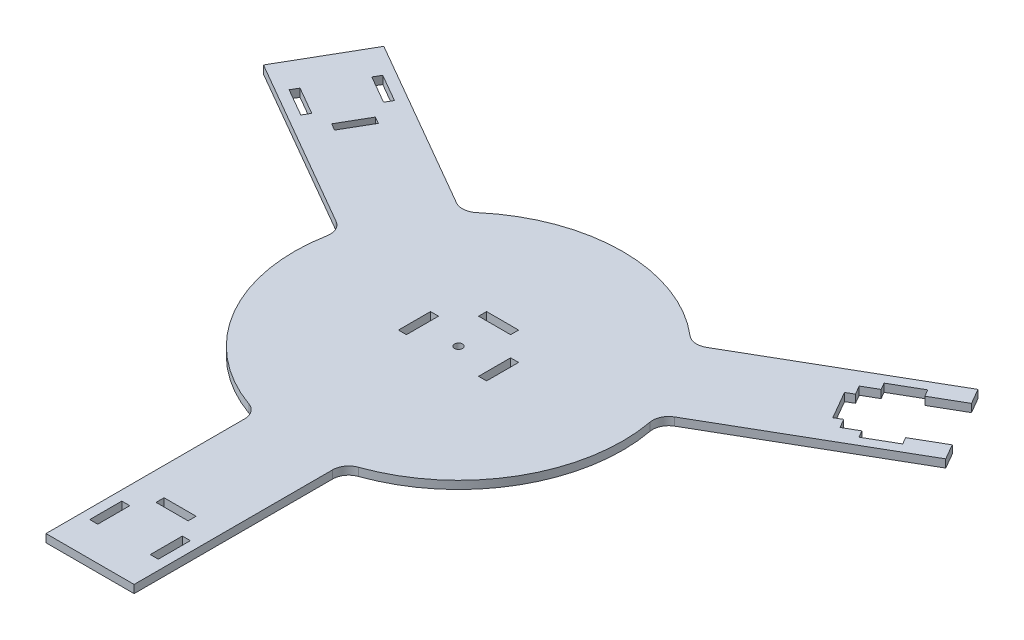
from build123d import *

# Parameters (mm, degrees)
SKETCH1_R      = 3.175
SKETCH1_W      = 25.4
SKETCH1_H      = 6.35
SKETCH1_W_2    = 6.35
SKETCH1_H_2    = 25.4
EXTRUDE2_DEPTH = 6.35
SKETCH2_W      = 6.35
SKETCH2_H      = 25.4
SKETCH2_W_2    = 25.4
SKETCH2_H_2    = 6.35
EXTRUDE4_DEPTH = 399.113447613


with BuildPart() as part:
    # Sketch1 → Extrude2 (new body)
    with BuildSketch(Plane(origin=(0, 0, 0), x_dir=(1, 0, 0), z_dir=(0, 1, 0))):
        with BuildLine():
            Line((-34.925, -292.1), (34.925, -292.1))
            Line((34.925, -292.1), (34.925, -134.703841816))
            ThreePointArc((34.925, -134.703841816), (37.255493422, -127.371493397), (43.391666667, -122.730166988))
            ThreePointArc((43.391666667, -122.730166988), (112.734856938, -65.0875), (127.983275756, 23.786797848))
            ThreePointArc((127.983275756, 23.786797848), (128.934695711, 31.421542964), (134.119449, 37.105983681))
            Line((134.119449, 37.105983681), (270.428520445, 115.804062773))
            Line((270.428520445, 115.804062773), (263.380020445, 128.01242289))
            Line((263.380020445, 128.01242289), (239.953167248, 114.48692289))
            Line((239.953167248, 114.48692289), (243.128167248, 108.987661576))
            Line((243.128167248, 108.987661576), (221.131121992, 96.287661576))
            Line((221.131121992, 96.287661576), (217.956121992, 101.78692289))
            Line((217.956121992, 101.78692289), (206.957599363, 95.43692289))
            Line((206.957599363, 95.43692289), (202.893599363, 102.475977372))
            Line((202.893599363, 102.475977372), (197.394338049, 99.300977372))
            Line((197.394338049, 99.300977372), (184.694338049, 121.298022628))
            Line((184.694338049, 121.298022628), (190.193599363, 124.473022628))
            Line((190.193599363, 124.473022628), (186.129599363, 131.51207711))
            Line((186.129599363, 131.51207711), (197.128121992, 137.86207711))
            Line((197.128121992, 137.86207711), (193.953121992, 143.361338424))
            Line((193.953121992, 143.361338424), (215.950167248, 156.061338424))
            Line((215.950167248, 156.061338424), (219.125167248, 150.56207711))
            Line((219.125167248, 150.56207711), (242.552020445, 164.08757711))
            Line((242.552020445, 164.08757711), (235.503520445, 176.295937227))
            Line((235.503520445, 176.295937227), (99.194449, 97.597858135))
            ThreePointArc((99.194449, 97.597858135), (91.679202289, 95.949950433), (84.591609089, 98.94336914))
            ThreePointArc((84.591609089, 98.94336914), (0, 130.175), (-84.591609089, 98.94336914))
            ThreePointArc((-84.591609089, 98.94336914), (-91.679202289, 95.949950433), (-99.194449, 97.597858135))
            Line((-99.194449, 97.597858135), (-235.503520445, 176.295937227))
            Line((-235.503520445, 176.295937227), (-270.428520445, 115.804062773))
            Line((-270.428520445, 115.804062773), (-134.119449, 37.105983681))
            ThreePointArc((-134.119449, 37.105983681), (-128.934695711, 31.421542964), (-127.983275756, 23.786797848))
            ThreePointArc((-127.983275756, 23.786797848), (-112.734856938, -65.0875), (-43.391666667, -122.730166988))
            ThreePointArc((-43.391666667, -122.730166988), (-37.255493422, -127.371493397), (-34.925, -134.703841816))
            Line((-34.925, -134.703841816), (-34.925, -292.1))
        make_face()
        with Locations(Location((0, 0, 0), (0, 0, 270))):
            Circle(SKETCH1_R, mode=Mode.SUBTRACT)
        with Locations((0, -223.901)):
            Rectangle(SKETCH1_W, SKETCH1_H, mode=Mode.SUBTRACT)
        with Locations((-24.003, -252.476)):
            Rectangle(SKETCH1_W_2, SKETCH1_H_2, mode=Mode.SUBTRACT)
        with Locations((24.003, -252.476)):
            Rectangle(SKETCH1_W_2, SKETCH1_H_2, mode=Mode.SUBTRACT)
        Polygon((-197.504323276, 99.237477372), (-184.804323276, 121.234522628), (-190.30358459, 124.409522628), (-203.00358459, 102.412477372), align=None, mode=Mode.SUBTRACT)
        Polygon((-194.063107218, 143.297838424), (-197.238107218, 137.79857711), (-219.235152474, 150.49857711), (-216.060152474, 155.997838424), align=None, mode=Mode.SUBTRACT)
        Polygon((-240.063152474, 114.42342289), (-243.238152474, 108.924161576), (-221.241107218, 96.224161576), (-218.066107218, 101.72342289), align=None, mode=Mode.SUBTRACT)
    extrude(amount=EXTRUDE2_DEPTH)

    # Sketch2 → Extrude4 (cut, through all)
    with BuildSketch(Plane(origin=(0, 6.35, 0), x_dir=(1, 0, 0), z_dir=(0, 1, 0))):
        with Locations((-31.75, 0)):
            Rectangle(SKETCH2_W, SKETCH2_H)
        with Locations((0, 31.75)):
            Rectangle(SKETCH2_W_2, SKETCH2_H_2)
        with Locations((31.75, 0)):
            Rectangle(SKETCH2_W, SKETCH2_H)
    extrude(amount=-EXTRUDE4_DEPTH, mode=Mode.SUBTRACT)


solid = part.part
